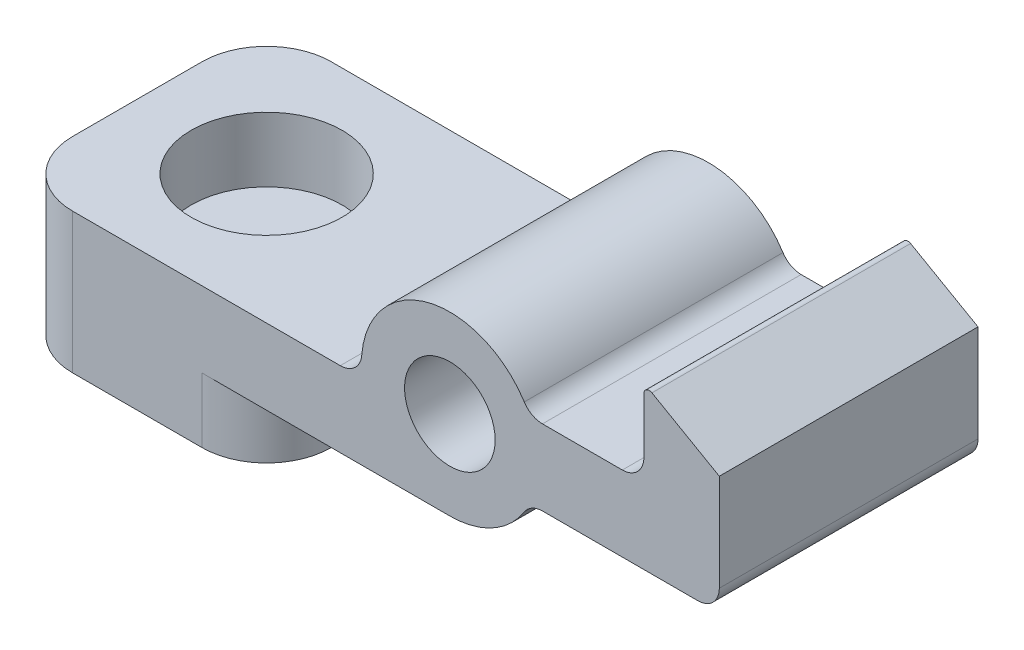
from build123d import *

# Parameters (mm, degrees)
SKETCH1_R           = 2.1
BOSS_EXTRUDE1_DEPTH = 12
FILLET1_R           = 1
CUT_EXTRUDE1_DEPTH  = 12
FILLET3_R           = 0.25
FILLET4_R           = 3
BOSS_EXTRUDE2_DEPTH = 3
FILLET5_R           = 3
SKETCH7_R           = 3.5
CUT_EXTRUDE4_DEPTH  = 3


with BuildPart() as part:
    # Sketch1 → Boss-Extrude1 (new body)
    with BuildSketch(Plane.XY):
        with BuildLine():
            Line((12.5, 5.75), (12.5, -1.75))
            Line((12.5, -1.75), (3.707762128, -1.75))
            ThreePointArc((3.707762128, -1.75), (2.194880407, -3.463018914), (0, -4.1))
            Line((0, -4.1), (-20.5, -4.1))
            Line((-20.5, -4.1), (-20.5, -0.6))
            Line((-20.5, -0.6), (-4.055859958, -0.6))
            ThreePointArc((-4.055859958, -0.6), (-1.187820704, 3.924166405), (3.707762128, 1.75))
            Line((3.707762128, 1.75), (9, 1.75))
            Line((9, 1.75), (9, 5.75))
            Line((9, 5.75), (12.5, 5.75))
        make_face()
        Circle(SKETCH1_R, mode=Mode.SUBTRACT)
    extrude(amount=BOSS_EXTRUDE1_DEPTH)

    # Fillet1
    fillet1_edges = [part.edges().sort_by_distance(p)[0] for p in [
        (3.707762128, -1.75, 6),
        (12.5, -1.75, 6),
        (9, 1.75, 6),
        (3.707762128, 1.75, 6),
        (-4.055859958, -0.6, 6),
    ]]
    fillet(fillet1_edges, radius=FILLET1_R)

    # Sketch3 → Cut-Extrude1 (cut)
    with BuildSketch(Plane.XY.offset(12)):
        Polygon((9, 5.75), (12.5, 5.75), (12.5, 3.75), align=None)
    extrude(amount=-CUT_EXTRUDE1_DEPTH, mode=Mode.SUBTRACT)

    # Fillet3
    fillet3_edges = [part.edges().sort_by_distance(p)[0] for p in [
        (9, 5.75, 6),
    ]]
    fillet(fillet3_edges, radius=FILLET3_R)

    # Fillet4
    fillet4_edges = [part.edges().sort_by_distance(p)[0] for p in [
        (-20.5, -2.35, 0),
        (-20.5, -2.35, 12),
    ]]
    fillet(fillet4_edges, radius=FILLET4_R)

    # Sketch6 → Boss-Extrude2 (add)
    with BuildSketch(Plane.XZ.offset(4.1)):
        with BuildLine():
            Line((-8.5, 12), (-8.5, 0))
            Line((-8.5, 0), (-17.5, 0))
            ThreePointArc((-17.5, 0), (-19.621320344, 0.878679656), (-20.5, 3))
            Line((-20.5, 3), (-20.5, 9))
            ThreePointArc((-20.5, 9), (-19.621320344, 11.121320344), (-17.5, 12))
            Line((-17.5, 12), (-8.5, 12))
        make_face()
    extrude(amount=BOSS_EXTRUDE2_DEPTH)

    # Fillet5
    fillet5_edges = [part.edges().sort_by_distance(p)[0] for p in [
        (-8.5, -5.6, 0),
        (-8.5, -5.6, 12),
    ]]
    fillet(fillet5_edges, radius=FILLET5_R)

    # Sketch7 → Cut-Extrude4 (cut)
    with BuildSketch(Plane(origin=(0, -0.6, 0), x_dir=(1, 0, 0), z_dir=(0, 1, 0))):
        with Locations(Location((-14.5, -6, 0), (0, 0, 180))):
            Circle(SKETCH7_R)
    extrude(amount=-CUT_EXTRUDE4_DEPTH, mode=Mode.SUBTRACT)


solid = part.part
